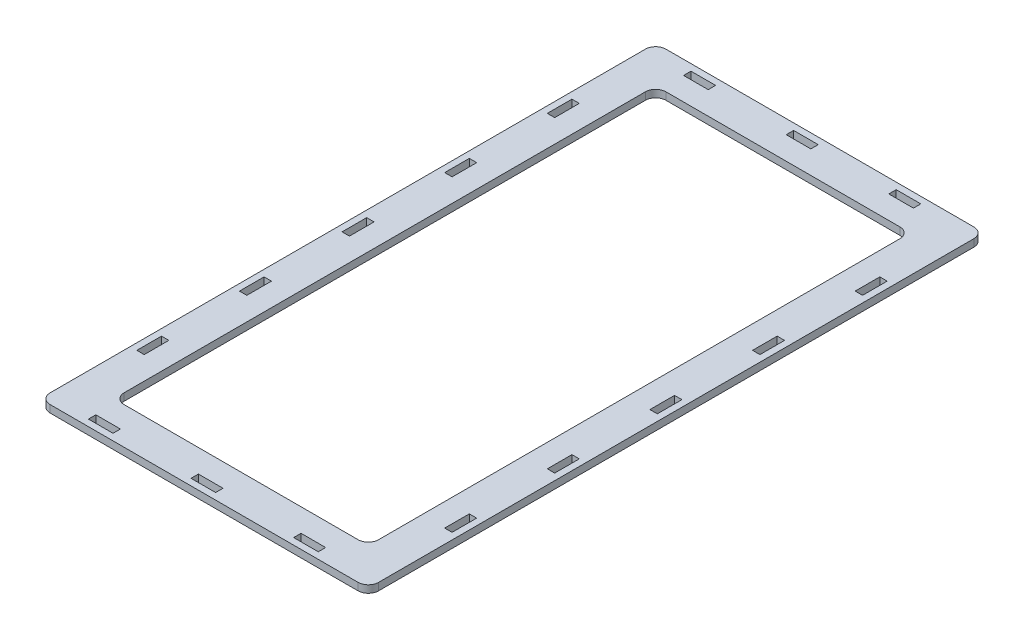
from build123d import *

# Parameters (mm, degrees)
SKETCH_1_W               = 800
SKETCH_1_H               = 1500
SKETCH_1_W_2             = 620
SKETCH_1_H_2             = 1320
EXTRUDE_1_DEPTH          = 18
SKETCH_1_5_W             = 18
SKETCH_1_5_H             = 60
CUT_EXTRUDE_1_DEPTH      = 851.190566873
PATTERN_LINEAR_1_COUNT   = 5
PATTERN_LINEAR_1_PITCH   = 250
MIRROR_1_COPY_1_SKETCH_W = 18
MIRROR_1_COPY_1_SKETCH_H = 60
MIRROR_1_COPY_1_DEPTH    = 851.190566873
MIRROR_1_COPY_2_SKETCH_W = 18
MIRROR_1_COPY_2_SKETCH_H = 60
MIRROR_1_COPY_2_DEPTH    = 851.190566873
MIRROR_1_COPY_3_SKETCH_W = 18
MIRROR_1_COPY_3_SKETCH_H = 60
MIRROR_1_COPY_3_DEPTH    = 851.190566873
MIRROR_1_COPY_4_SKETCH_W = 18
MIRROR_1_COPY_4_SKETCH_H = 60
MIRROR_1_COPY_4_DEPTH    = 851.190566873
SKETCH_1_4_W             = 60
SKETCH_1_4_H             = 18
CUT_EXTRUDE_2_DEPTH      = 851.190566873
PATTERN_LINEAR_2_COUNT   = 3
PATTERN_LINEAR_2_PITCH   = 250
MIRROR_2_COPY_1_SKETCH_W = 60
MIRROR_2_COPY_1_SKETCH_H = 18
MIRROR_2_COPY_1_DEPTH    = 851.190566873
MIRROR_2_COPY_2_SKETCH_W = 60
MIRROR_2_COPY_2_SKETCH_H = 18
MIRROR_2_COPY_2_DEPTH    = 851.190566873
FILLET_1_R               = 25
FILLET_2_R               = 25


with BuildPart() as part:
    # 草图1 → 凸台-拉伸1 (new body)
    with BuildSketch(Plane(origin=(0, 0, 0), x_dir=(1, 0, 0), z_dir=(0, 1, 0))):
        Rectangle(SKETCH_1_W, SKETCH_1_H)
        Rectangle(SKETCH_1_W_2, SKETCH_1_H_2, mode=Mode.SUBTRACT)
    extrude(amount=EXTRUDE_1_DEPTH)

    # 草图1<5> → 切除-拉伸1 (cut, through all)
    with BuildSketch(Plane(origin=(0, 0, 0), x_dir=(1, 0, 0), z_dir=(0, 1, 0))):
        with Locations((-375, -500)):
            Rectangle(SKETCH_1_5_W, SKETCH_1_5_H)
    cut_extrude_1 = extrude(amount=CUT_EXTRUDE_1_DEPTH, mode=Mode.SUBTRACT)

    # 阵列(线性)1: 切除-拉伸1 ×5
    with Locations(*[(0, 0, -i * PATTERN_LINEAR_1_PITCH) for i in range(1, PATTERN_LINEAR_1_COUNT)]):
        add(cut_extrude_1, mode=Mode.SUBTRACT)

    # 镜向1: 切除-拉伸1 across plane
    add(cut_extrude_1.mirror(Plane(origin=(0, 0, 0), x_dir=(0, 0, 1), z_dir=(1, 0, 0))), mode=Mode.SUBTRACT)

    # 镜向1 copy 1 sketch → 镜向1 copy 1 (cut, through all)
    with BuildSketch(Plane(origin=(0, 0, -250), x_dir=(-1, 0, 0), z_dir=(0, 1, 0))):
        with Locations((-375, 500)):
            Rectangle(MIRROR_1_COPY_1_SKETCH_W, MIRROR_1_COPY_1_SKETCH_H)
    extrude(amount=MIRROR_1_COPY_1_DEPTH, mode=Mode.SUBTRACT)

    # 镜向1 copy 2 sketch → 镜向1 copy 2 (cut, through all)
    with BuildSketch(Plane(origin=(0, 0, -500), x_dir=(-1, 0, 0), z_dir=(0, 1, 0))):
        with Locations((-375, 500)):
            Rectangle(MIRROR_1_COPY_2_SKETCH_W, MIRROR_1_COPY_2_SKETCH_H)
    extrude(amount=MIRROR_1_COPY_2_DEPTH, mode=Mode.SUBTRACT)

    # 镜向1 copy 3 sketch → 镜向1 copy 3 (cut, through all)
    with BuildSketch(Plane(origin=(0, 0, -750), x_dir=(-1, 0, 0), z_dir=(0, 1, 0))):
        with Locations((-375, 500)):
            Rectangle(MIRROR_1_COPY_3_SKETCH_W, MIRROR_1_COPY_3_SKETCH_H)
    extrude(amount=MIRROR_1_COPY_3_DEPTH, mode=Mode.SUBTRACT)

    # 镜向1 copy 4 sketch → 镜向1 copy 4 (cut, through all)
    with BuildSketch(Plane(origin=(0, 0, -1000), x_dir=(-1, 0, 0), z_dir=(0, 1, 0))):
        with Locations((-375, 500)):
            Rectangle(MIRROR_1_COPY_4_SKETCH_W, MIRROR_1_COPY_4_SKETCH_H)
    extrude(amount=MIRROR_1_COPY_4_DEPTH, mode=Mode.SUBTRACT)

    # 草图1<4> → 切除-拉伸2 (cut, through all)
    with BuildSketch(Plane(origin=(0, 0, 0), x_dir=(1, 0, 0), z_dir=(0, 1, 0))):
        with Locations((-268, -725)):
            Rectangle(SKETCH_1_4_W, SKETCH_1_4_H)
    cut_extrude_2 = extrude(amount=CUT_EXTRUDE_2_DEPTH, mode=Mode.SUBTRACT)

    # 阵列(线性)2: 切除-拉伸2 ×3
    with Locations(*[(i * PATTERN_LINEAR_2_PITCH, 0, 0) for i in range(1, PATTERN_LINEAR_2_COUNT)]):
        add(cut_extrude_2, mode=Mode.SUBTRACT)

    # 镜向2: 切除-拉伸2 across plane
    add(cut_extrude_2.mirror(Plane.XY), mode=Mode.SUBTRACT)

    # 镜向2 copy 1 sketch → 镜向2 copy 1 (cut, through all)
    with BuildSketch(Plane(origin=(250, 0, 0), x_dir=(1, 0, 0), z_dir=(0, 1, 0))):
        with Locations((-268, 725)):
            Rectangle(MIRROR_2_COPY_1_SKETCH_W, MIRROR_2_COPY_1_SKETCH_H)
    extrude(amount=MIRROR_2_COPY_1_DEPTH, mode=Mode.SUBTRACT)

    # 镜向2 copy 2 sketch → 镜向2 copy 2 (cut, through all)
    with BuildSketch(Plane(origin=(500, 0, 0), x_dir=(1, 0, 0), z_dir=(0, 1, 0))):
        with Locations((-268, 725)):
            Rectangle(MIRROR_2_COPY_2_SKETCH_W, MIRROR_2_COPY_2_SKETCH_H)
    extrude(amount=MIRROR_2_COPY_2_DEPTH, mode=Mode.SUBTRACT)

    # 圆角1
    fillet_1_edges = [part.edges().sort_by_distance(p)[0] for p in [
        (-400, 9, -750),
        (400, 9, -750),
        (400, 9, 750),
        (-400, 9, 750),
    ]]
    fillet(fillet_1_edges, radius=FILLET_1_R)

    # 圆角2
    fillet_2_edges = [part.edges().sort_by_distance(p)[0] for p in [
        (-310, 9, -660),
        (310, 9, -660),
        (310, 9, 660),
        (-310, 9, 660),
    ]]
    fillet(fillet_2_edges, radius=FILLET_2_R)


solid = part.part
